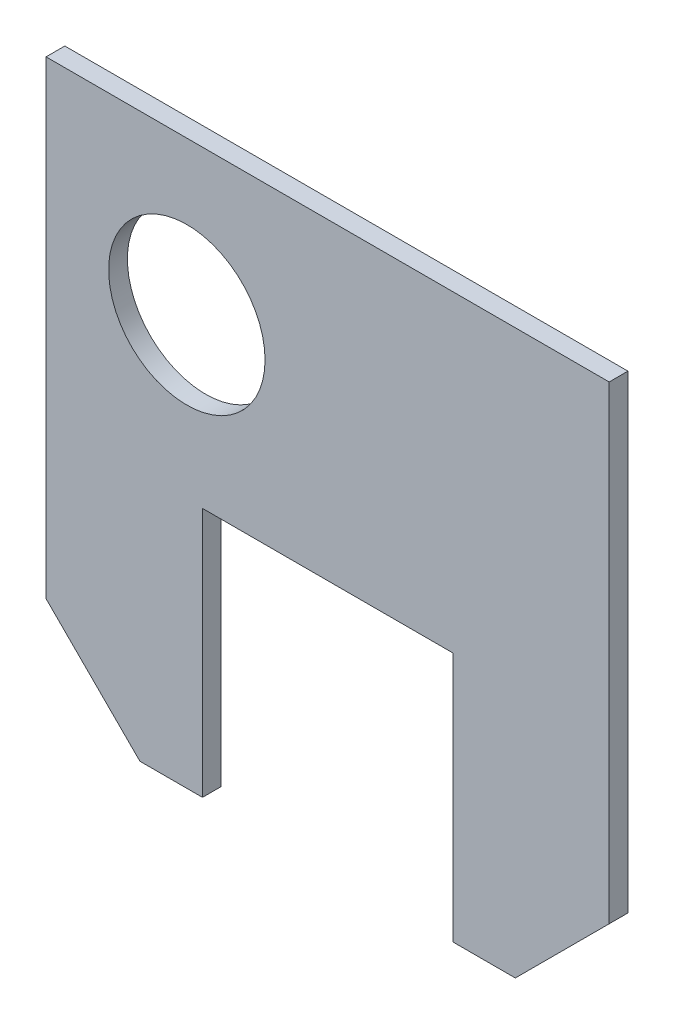
from build123d import *

# Parameters (mm, degrees)
EXTRUSION1_DEPTH        = 3
ESQUISSE2_R             = 12.5
ENL_V_MAT_EXTRU_1_DEPTH = 98.956642072


with BuildPart() as part:
    # Esquisse1 → Extrusion1 (new body)
    with BuildSketch(Plane.XY):
        Polygon((3.720449438, -58.220224719), (-11.279550562, -43.220224719), (-11.279550562, 31.779775281), (33.720449438, 31.779775281), (33.720449438, -18.220224719), (13.720449438, -18.220224719), (13.720449438, -58.220224719), align=None)
    extrusion1 = extrude(amount=EXTRUSION1_DEPTH)

    # Symétrie1: Extrusion1 across plane
    add(extrusion1.mirror(Plane(origin=(33.720449438, 31.779775281, 3), x_dir=(0, 0, 1), z_dir=(-1, 0, 0))))

    # Esquisse2 → Enlèv. mat.-Extru.1 (cut, through all)
    with BuildSketch(Plane.XY.offset(3)):
        with Locations((11.220449438, 7.325247065)):
            Circle(ESQUISSE2_R)
    extrude(amount=-ENL_V_MAT_EXTRU_1_DEPTH, mode=Mode.SUBTRACT)


solid = part.part
